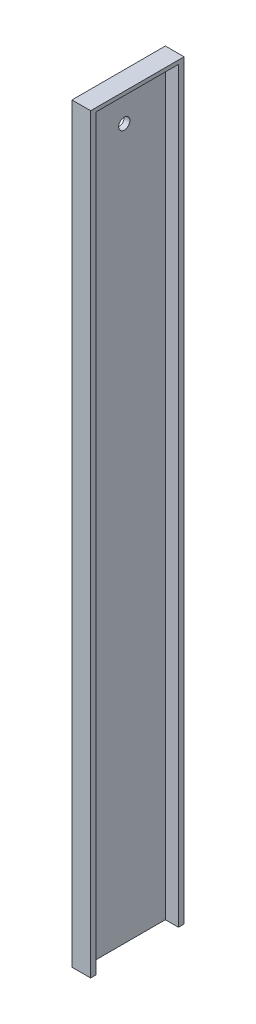
from build123d import *

# Parameters (mm, degrees)
BOSS_EXTRUDE1_DEPTH = 100
BOSS_EXTRUDE2_START = 100
SKETCH1_3_W         = 3.5
SKETCH1_3_H         = 22
BOSS_EXTRUDE2_DEPTH = 1
SKETCH2_R           = 1.5
CUT_EXTRUDE1_DEPTH  = 25


with BuildPart() as part:
    # Sketch1 → Boss-Extrude1 (new, symmetric)
    with BuildSketch(Plane(origin=(0, 0, 0), x_dir=(1, 0, 0), z_dir=(0, 1, 0))):
        Polygon((-2.5, -12.5), (-2.5, 12.5), (2.5, 12.5), (2.5, 11), (-1, 11), (-1, -11), (2.5, -11), (2.5, -12.5), align=None)
    extrude(amount=BOSS_EXTRUDE1_DEPTH, both=True)

    # Sketch1<3> → Boss-Extrude2 (add)
    with BuildSketch(Plane(origin=(0, 0, 0), x_dir=(1, 0, 0), z_dir=(0, 1, 0)).offset(BOSS_EXTRUDE2_START)):
        with Locations((0.75, 0)):
            Rectangle(SKETCH1_3_W, SKETCH1_3_H)
        Polygon((2.5, 11), (-1, 11), (-1, -11), (2.5, -11), (2.5, -12.5), (-2.5, -12.5), (-2.5, 12.5), (2.5, 12.5), align=None)
    extrude(amount=BOSS_EXTRUDE2_DEPTH)

    # Sketch2 → Cut-Extrude1 (cut)
    with BuildSketch(Plane(origin=(-1, 0, 0), x_dir=(0, 0, -1), z_dir=(1, 0, 0))):
        with Locations((0, 90)):
            Circle(SKETCH2_R)
    extrude(amount=-CUT_EXTRUDE1_DEPTH, mode=Mode.SUBTRACT)


solid = part.part
